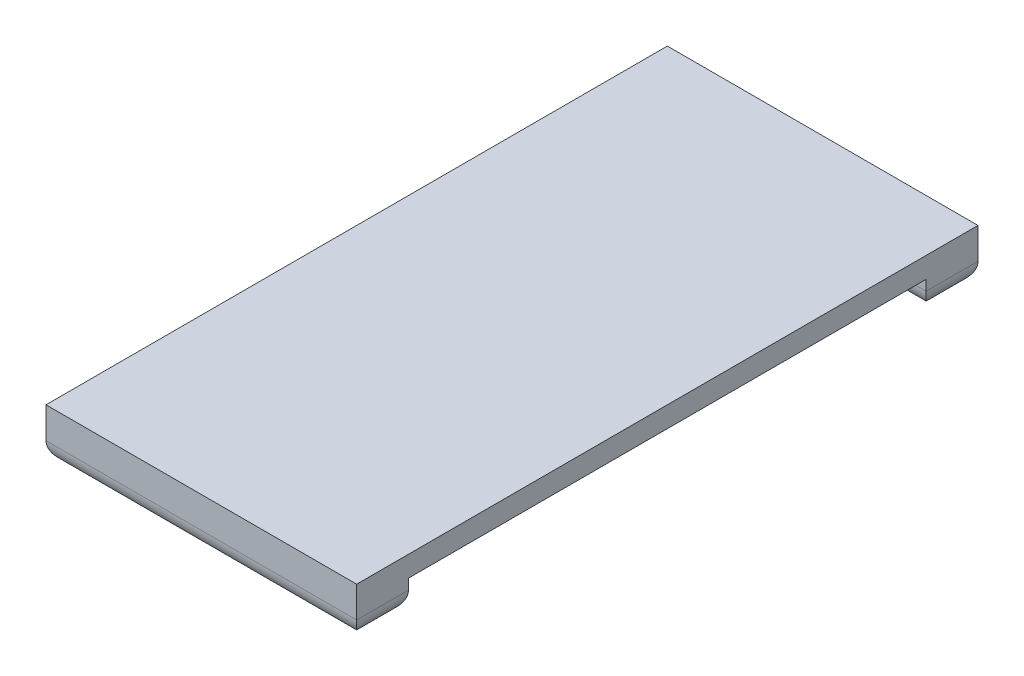
from build123d import *

# Parameters (mm, degrees)
SKETCH1_W           = 300
SKETCH1_H           = 600
BOSS_EXTRUDE1_DEPTH = 50
SKETCH2_W           = 300
SKETCH2_H           = 500
CUT_EXTRUDE1_DEPTH  = 30
SKETCH3_W           = 50
SKETCH3_H           = 500
BOSS_EXTRUDE2_DEPTH = 36
FILLET1_R           = 20


with BuildPart() as part:
    # Sketch1 → Boss-Extrude1 (new body)
    with BuildSketch(Plane(origin=(0, 0, 0), x_dir=(1, 0, 0), z_dir=(0, 1, 0))):
        with Locations((29.676258993, 266.816546763)):
            Rectangle(SKETCH1_W, SKETCH1_H)
    extrude(amount=BOSS_EXTRUDE1_DEPTH)

    # Sketch2 → Cut-Extrude1 (cut)
    with BuildSketch(Plane(origin=(0, 0, 0), x_dir=(-1, 0, 0), z_dir=(0, -1, 0))):
        with Locations((-29.676258993, 266.816546763)):
            Rectangle(SKETCH2_W, SKETCH2_H)
    extrude(amount=-CUT_EXTRUDE1_DEPTH, mode=Mode.SUBTRACT)

    # Sketch3 → Boss-Extrude2 (add)
    with BuildSketch(Plane(origin=(0, 0, 0), x_dir=(-1, 0, 0), z_dir=(0, -1, 0))):
        with Locations((-29.676258993, 266.816546763)):
            Rectangle(SKETCH3_W, SKETCH3_H)
    extrude(amount=-BOSS_EXTRUDE2_DEPTH)

    # Fillet1
    fillet1_edges = [part.edges().sort_by_distance(p)[0] for p in [
        (-120.323741007, 0, 8.183453237),
        (179.676258993, 0, -541.816546763),
        (-57.823741007, 0, -516.816546763),
        (117.176258993, 0, -16.816546763),
        (117.176258993, 0, -516.816546763),
        (-57.823741007, 0, -16.816546763),
        (4.676258993, 0, -266.816546763),
        (54.676258993, 0, -266.816546763),
        (29.676258993, 0, -566.816546763),
        (179.676258993, 0, 8.183453237),
        (29.676258993, 0, 33.183453237),
        (-120.323741007, 0, -541.816546763),
    ]]
    fillet(fillet1_edges, radius=FILLET1_R)


solid = part.part
